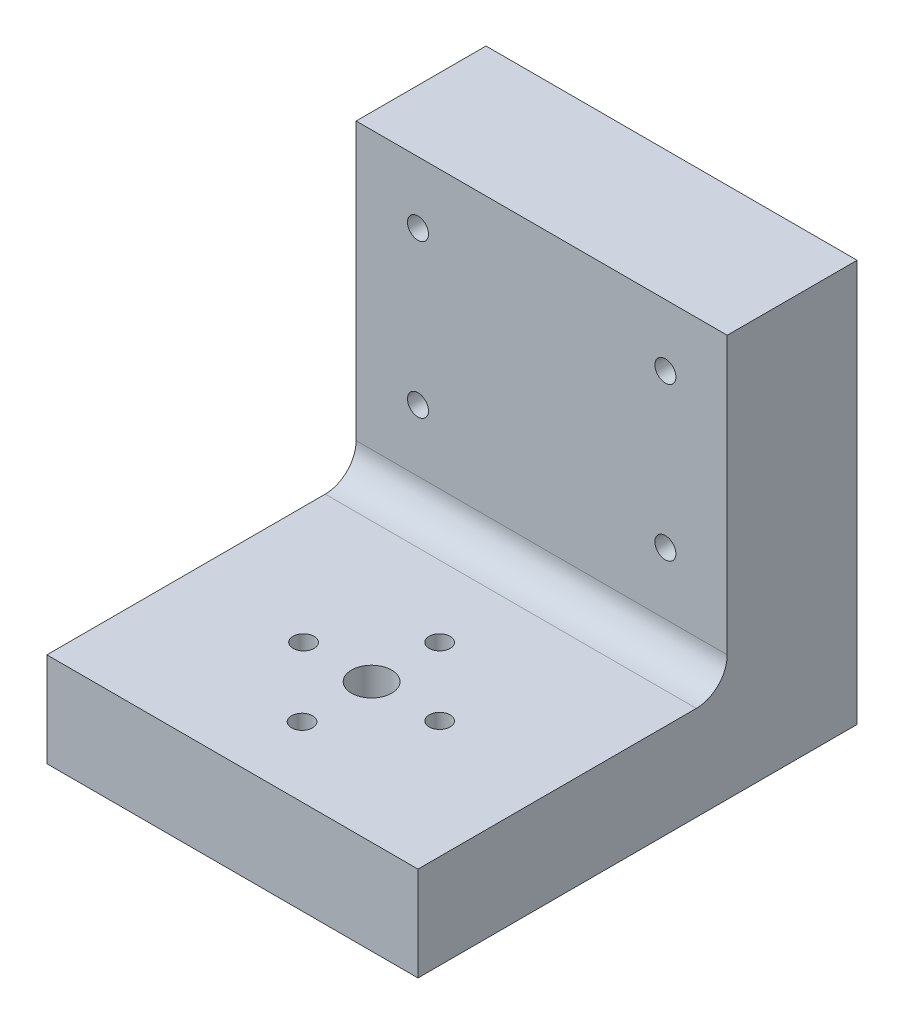
from build123d import *

# Parameters (mm, degrees)
SKETCH1_W           = 60
SKETCH1_H           = 65
BOSS_EXTRUDE1_DEPTH = 21
SKETCH2_W           = 60
SKETCH2_H           = 50
BOSS_EXTRUDE2_DEPTH = 15.25
FILLET1_R           = 5
SKETCH3_R           = 3.25
SKETCH3_R_2         = 1.7
CUT_EXTRUDE4_DEPTH  = 15.25
SKETCH10_R          = 1.7
CUT_EXTRUDE5_DEPTH  = 21


with BuildPart() as part:
    # Sketch1 → Boss-Extrude1 (new body)
    with BuildSketch(Plane.XY):
        with Locations((-22.911585366, 3.368902439)):
            Rectangle(SKETCH1_W, SKETCH1_H)
    extrude(amount=BOSS_EXTRUDE1_DEPTH)

    # Sketch2 → Boss-Extrude2 (add)
    with BuildSketch(Plane.XZ.offset(29.131097561)):
        with Locations((-22.911585366, 46)):
            Rectangle(SKETCH2_W, SKETCH2_H)
    extrude(amount=-BOSS_EXTRUDE2_DEPTH)

    # Fillet1
    fillet1_edges = [part.edges().sort_by_distance(p)[0] for p in [
        (-22.911585366, -13.881097561, 21),
    ]]
    fillet(fillet1_edges, radius=FILLET1_R)

    # Sketch3 → Cut-Extrude4 (cut)
    with BuildSketch(Plane(origin=(0, -13.881097561, 0), x_dir=(1, 0, 0), z_dir=(0, 1, 0))):
        with Locations(Location((-22.911585366, -48.5, 0), (0, 0, 270))):
            Circle(SKETCH3_R)
        with Locations(Location((-11.911585366, -48.5, 0), (0, 0, 270))):
            Circle(SKETCH3_R_2)
        with Locations(Location((-22.911585366, -59.75, 0), (0, 0, 270))):
            Circle(SKETCH3_R_2)
        with Locations(Location((-33.911585366, -48.5, 0), (0, 0, 270))):
            Circle(SKETCH3_R_2)
        with Locations(Location((-22.911585366, -37.5, 0), (0, 0, 270))):
            Circle(SKETCH3_R_2)
    extrude(amount=-CUT_EXTRUDE4_DEPTH, mode=Mode.SUBTRACT)

    # Sketch10 → Cut-Extrude5 (cut)
    with BuildSketch(Plane.XY.offset(21)):
        with Locations((-2.911585366, 25.868902439)):
            Circle(SKETCH10_R)
        with Locations((-2.911585366, 1.118902439)):
            Circle(SKETCH10_R)
        with Locations((-42.911585366, 25.868902439)):
            Circle(SKETCH10_R)
        with Locations((-42.911585366, 1.118902439)):
            Circle(SKETCH10_R)
    extrude(amount=-CUT_EXTRUDE5_DEPTH, mode=Mode.SUBTRACT)


solid = part.part
